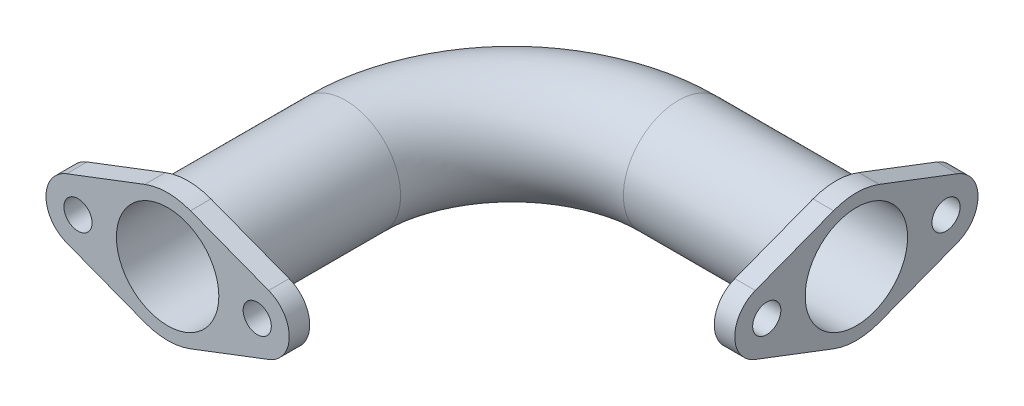
from build123d import *

# Parameters (mm, degrees)
SWEEP3_PROFILE_R     = 21.5
CUT_SWEEP1_PROFILE_R = 20
SKETCH23_R           = 5.5
SKETCH23_R_2         = 20
BOSS_EXTRUDE2_DEPTH  = 8
BOSS_EXTRUDE3_START  = 8
SKETCH26_R           = 5.5
SKETCH26_R_2         = 20
BOSS_EXTRUDE3_DEPTH  = 8


with BuildPart() as part:
    # Sweep3: sweep along a path in Sketch1
    with BuildLine(Plane(origin=(0, 0, 0), x_dir=(1, 0, 0), z_dir=(0, 1, 0))) as sweep3_path:
        Line((105, 126.5), (43.5, 126.5))
        ThreePointArc((43.5, 126.5), (-2.461940777, 107.461940777), (-21.5, 61.5))
        Line((-21.5, 61.5), (-21.5, 0))
    # Sweep3 profile (on start of the path) → Sweep3 (sweep)
    with BuildSketch(Plane(origin=(105, 0, -126.5), x_dir=(0, 0, -1), z_dir=(-1, 0, 0))):
        Circle(SWEEP3_PROFILE_R)
    sweep(path=sweep3_path.line)

    # Cut-Sweep1: sweep along a path in Sketch1<5>
    with BuildLine(Plane(origin=(0, 0, 0), x_dir=(1, 0, 0), z_dir=(0, 1, 0))) as cut_sweep1_path:
        Line((105, 126.5), (43.5, 126.5))
        ThreePointArc((43.5, 126.5), (-2.461940777, 107.461940777), (-21.5, 61.5))
        Line((-21.5, 61.5), (-21.5, 0))
    # Cut-Sweep1 profile (on start of the path) → Cut-Sweep1 (sweep, cut)
    with BuildSketch(Plane(origin=(105, 0, -126.5), x_dir=(0, 0, -1), z_dir=(-1, 0, 0))):
        Circle(CUT_SWEEP1_PROFILE_R)
    sweep(path=cut_sweep1_path.line, mode=Mode.SUBTRACT)

    # Sketch23 → Boss-Extrude2 (add)
    with BuildSketch(Plane(origin=(105, 0, 0), x_dir=(0, 0, -1), z_dir=(1, 0, 0))):
        with BuildLine():
            Line((117.571428571, 23.35124434), (87.035714286, 11.67562217))
            ThreePointArc((87.035714286, 11.67562217), (79, 0), (87.035714286, -11.67562217))
            Line((87.035714286, -11.67562217), (117.571428571, -23.35124434))
            ThreePointArc((117.571428571, -23.35124434), (126.5, -25), (135.428571429, -23.35124434))
            Line((135.428571429, -23.35124434), (165.964285714, -11.67562217))
            ThreePointArc((165.964285714, -11.67562217), (174, 0), (165.964285714, 11.67562217))
            Line((165.964285714, 11.67562217), (135.428571429, 23.35124434))
            ThreePointArc((135.428571429, 23.35124434), (126.5, 25), (117.571428571, 23.35124434))
        make_face()
        with Locations((91.5, 0)):
            Circle(SKETCH23_R, mode=Mode.SUBTRACT)
        with Locations((161.5, 0)):
            Circle(SKETCH23_R, mode=Mode.SUBTRACT)
        with Locations((126.5, 0)):
            Circle(SKETCH23_R_2, mode=Mode.SUBTRACT)
    extrude(amount=BOSS_EXTRUDE2_DEPTH)

    # Sketch26 → Boss-Extrude3 (add)
    with BuildSketch(Plane.XY.offset(BOSS_EXTRUDE3_START)):
        with BuildLine():
            Line((-30.428571429, 23.35124434), (-60.964285714, 11.67562217))
            ThreePointArc((-60.964285714, 11.67562217), (-69, 0), (-60.964285714, -11.67562217))
            Line((-60.964285714, -11.67562217), (-30.428571429, -23.35124434))
            ThreePointArc((-30.428571429, -23.35124434), (-21.5, -25), (-12.571428571, -23.35124434))
            Line((-12.571428571, -23.35124434), (17.964285714, -11.67562217))
            ThreePointArc((17.964285714, -11.67562217), (26, 0), (17.964285714, 11.67562217))
            Line((17.964285714, 11.67562217), (-12.571428571, 23.35124434))
            ThreePointArc((-12.571428571, 23.35124434), (-21.5, 25), (-30.428571429, 23.35124434))
        make_face()
        with Locations((-56.5, 0)):
            Circle(SKETCH26_R, mode=Mode.SUBTRACT)
        with Locations((13.5, 0)):
            Circle(SKETCH26_R, mode=Mode.SUBTRACT)
        with Locations((-21.5, 0)):
            Circle(SKETCH26_R_2, mode=Mode.SUBTRACT)
    extrude(amount=-BOSS_EXTRUDE3_DEPTH)


solid = part.part
